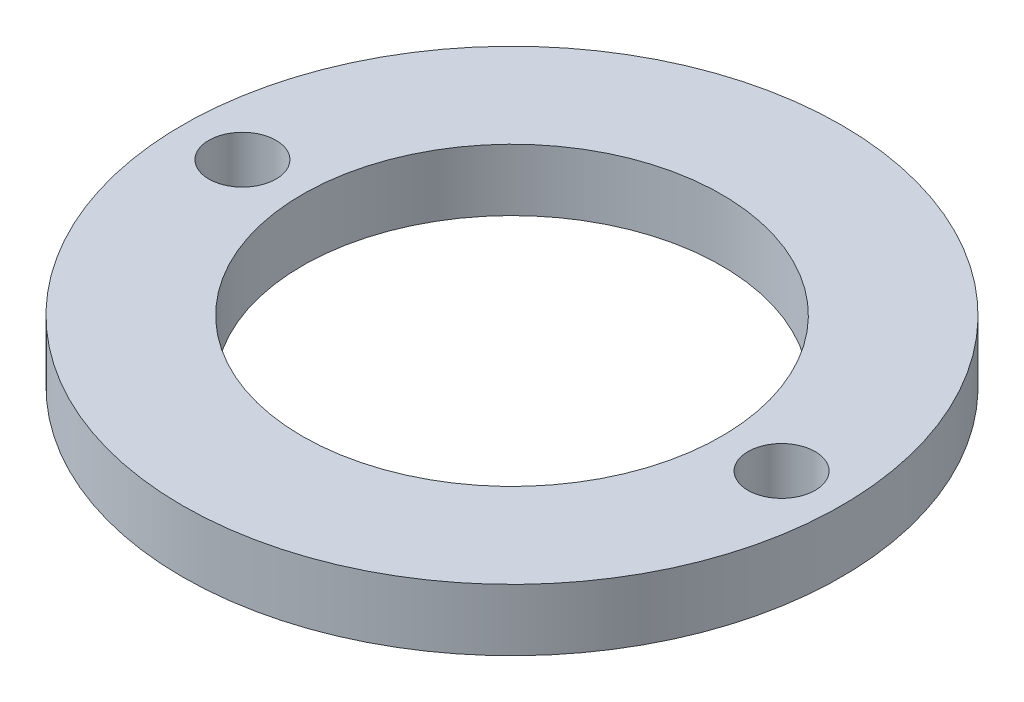
from build123d import *

# Parameters (mm, degrees)
SKETCH1_R             = 16
SKETCH1_R_2           = 10.175
BOSS_EXTRUDE1_DEPTH   = 3
F_4_CLEARANCE_HOLE1_D = 3.2639


with BuildPart() as part:
    # Sketch1 → Boss-Extrude1 (new body)
    with BuildSketch(Plane(origin=(0, 0, 0), x_dir=(1, 0, 0), z_dir=(0, 1, 0))):
        with Locations(Location((0, 0, 0), (0, 0, 270))):
            Circle(SKETCH1_R)
        with Locations(Location((0, 0, 0), (0, 0, 270))):
            Circle(SKETCH1_R_2, mode=Mode.SUBTRACT)
    extrude(amount=BOSS_EXTRUDE1_DEPTH)

    # #4 Clearance Hole1 (through all)
    with Locations(Plane(origin=(0, 3, 0), x_dir=(1, 0, 0), z_dir=(0, 1, 0))):
        with Locations((-13.0875, 0), (13.0875, 0)):
            Hole(F_4_CLEARANCE_HOLE1_D / 2)


solid = part.part
